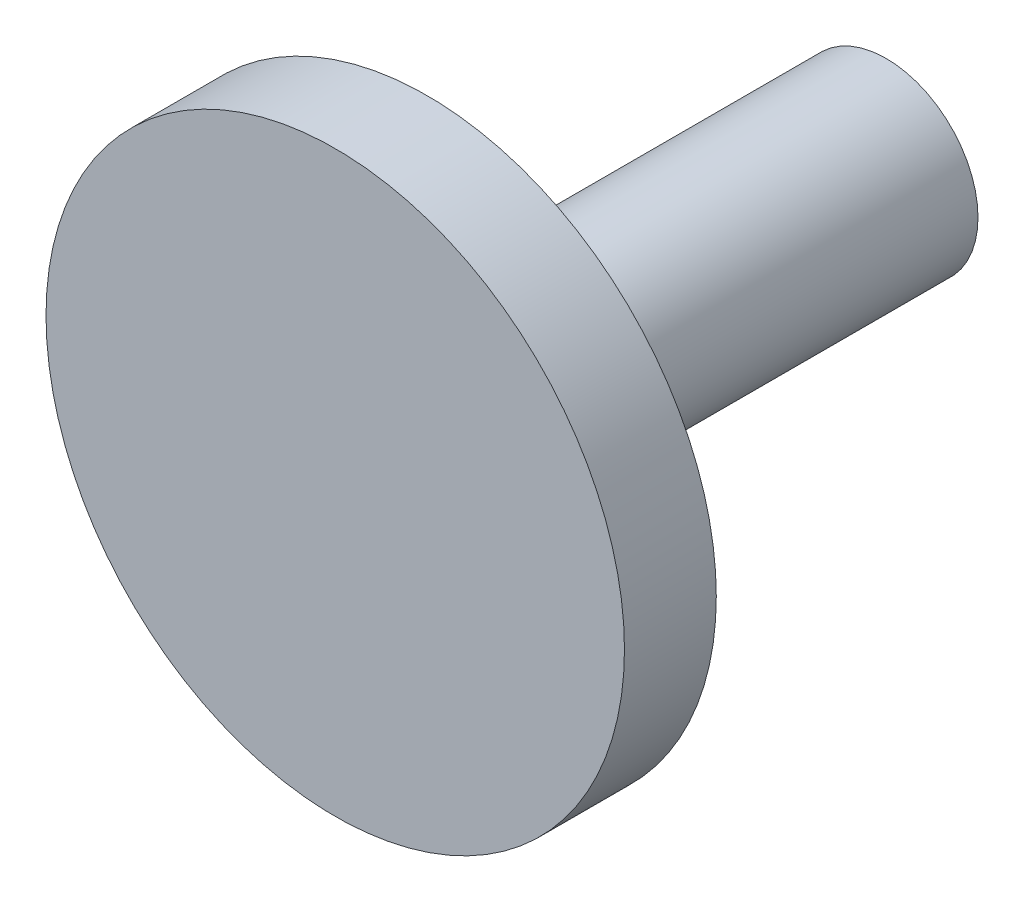
from build123d import *

# Parameters (mm, degrees)
SKETCH1_R           = 15.75
BOSS_EXTRUDE1_DEPTH = 5
SKETCH1_3_R         = 5
BOSS_EXTRUDE2_DEPTH = 25


with BuildPart() as part:
    # Sketch1 → Boss-Extrude1 (new body)
    with BuildSketch(Plane.XY):
        Circle(SKETCH1_R)
    extrude(amount=BOSS_EXTRUDE1_DEPTH)

    # Sketch1<3> → Boss-Extrude2 (add)
    with BuildSketch(Plane.XY):
        Circle(SKETCH1_3_R)
    extrude(amount=-BOSS_EXTRUDE2_DEPTH)


solid = part.part
